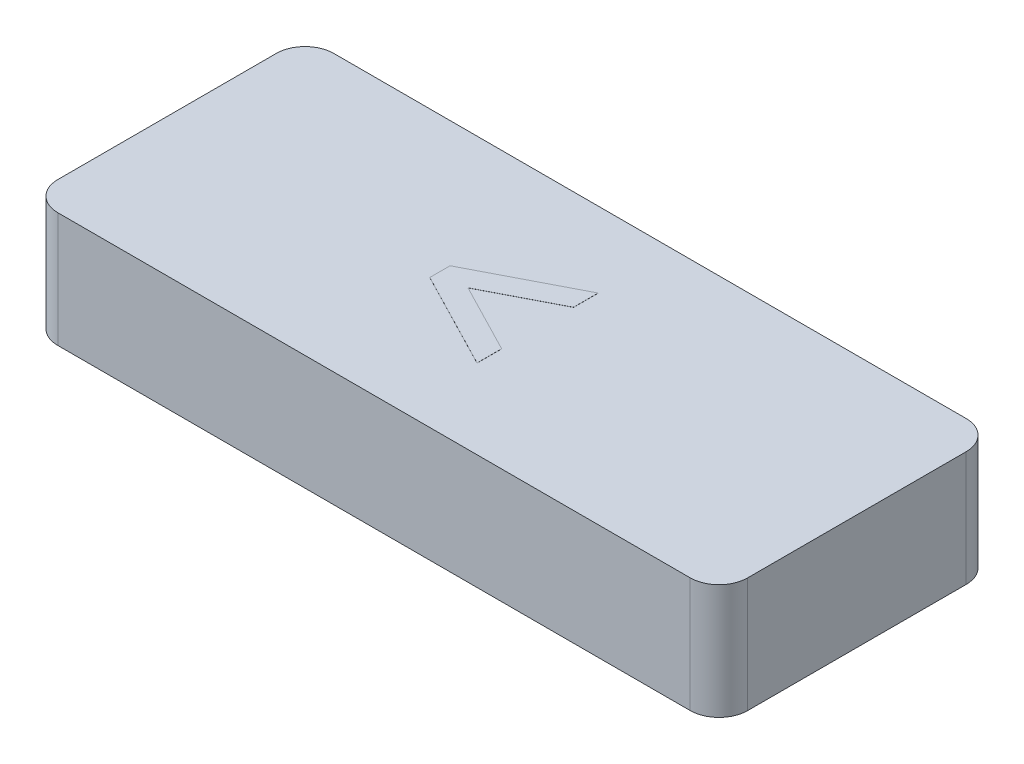
from build123d import *

# Parameters (mm, degrees)
SKETCH1_W           = 15.24
SKETCH1_H           = 6.096
BOSS_EXTRUDE1_DEPTH = 2.54
SHELL1_T            = -0.635
FILLET1_R           = 0.635
SKETCH2_R           = 1.5875
BOSS_EXTRUDE2_DEPTH = 1.905
BOSS_EXTRUDE3_DEPTH = 0.00254


with BuildPart() as part:
    # Sketch1 → Boss-Extrude1 (new body)
    with BuildSketch(Plane(origin=(0, 0, 0), x_dir=(1, 0, 0), z_dir=(0, 1, 0))):
        with Locations((7.62, 3.048)):
            Rectangle(SKETCH1_W, SKETCH1_H)
    extrude(amount=BOSS_EXTRUDE1_DEPTH)

    # Shell1
    shell1_openings = [part.faces().sort_by_distance(p)[0] for p in [
        (7.62, 0, -3.048),
    ]]
    offset(amount=SHELL1_T, openings=shell1_openings, kind=Kind.INTERSECTION)

    # Fillet1
    fillet1_edges = [part.edges().sort_by_distance(p)[0] for p in [
        (0, 1.27, 0),
        (15.24, 1.27, 0),
        (15.24, 1.27, -6.096),
        (0, 1.27, -6.096),
    ]]
    fillet(fillet1_edges, radius=FILLET1_R)

    # Sketch2 → Boss-Extrude2 (add)
    with BuildSketch(Plane.XZ.offset(-1.905)):
        with Locations(Location((7.62, -3.048, 0), (0, 0, 270))):
            Circle(SKETCH2_R)
    extrude(amount=BOSS_EXTRUDE2_DEPTH)

    # Sketch3 → Boss-Extrude3 (add)
    with BuildSketch(Plane(origin=(0, 2.54, 0), x_dir=(1, 0, 0), z_dir=(0, 1, 0))):
        Polygon((8.142002564, 2.297397436), (8.142002564, 1.753602364), (5.984630769, 2.867269231), (5.984630769, 3.315661659), (8.142002564, 4.429328526), (8.142002564, 3.884897436), (6.604111939, 3.091147436), align=None)
    extrude(amount=BOSS_EXTRUDE3_DEPTH)


solid = part.part
